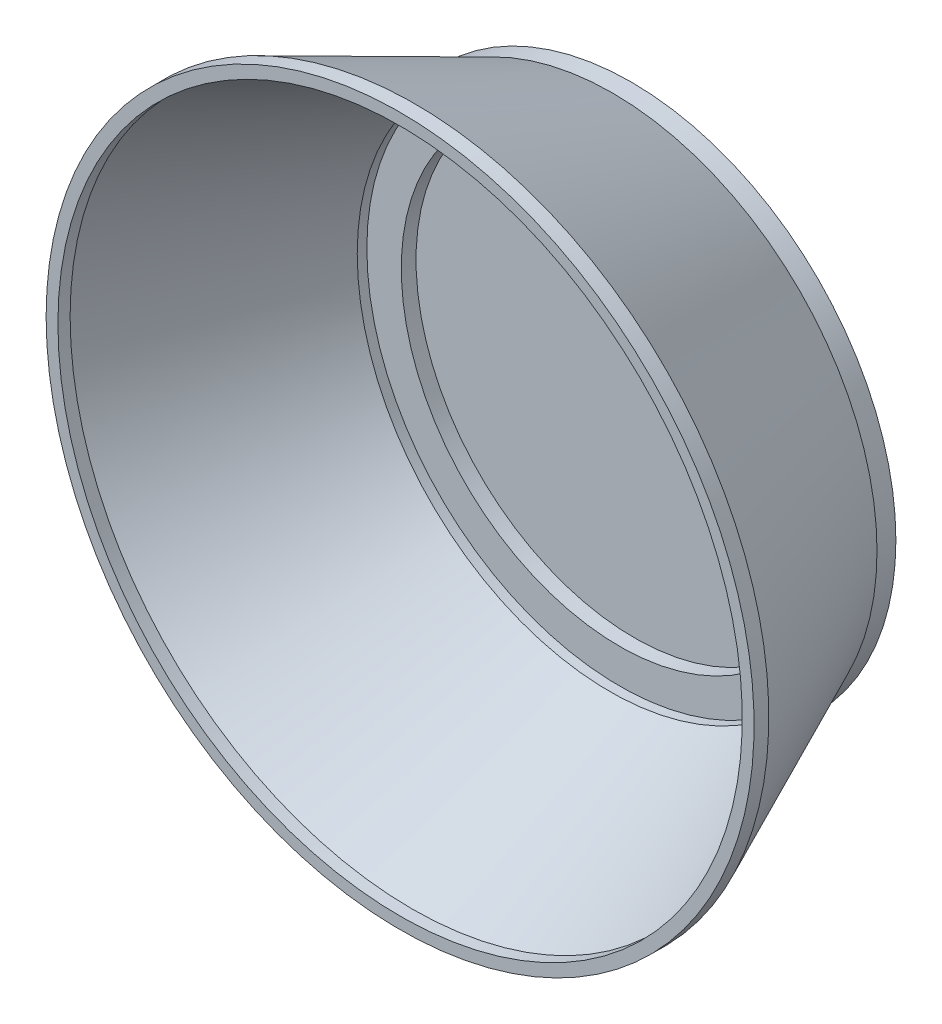
from build123d import *

# Parameters (mm, degrees)
SHELL1_T = -1.27


with BuildPart() as part:
    # Sketch1 → Revolve1 (revolve)
    with BuildSketch(Plane(origin=(0, 0, 0), x_dir=(-1, 0, 0), z_dir=(0, 1, 0)), mode=Mode.PRIVATE) as revolve1_sk:
        Polygon((0, 0), (0, 26.4795), (-38.1, 26.4795), (-38.1, 24.892), (-28.47032967, 3.6195), (-28.47032967, 1.5875), (-24.765, 1.5875), (-24.765, 0), align=None)
    revolve(revolve1_sk.sketch.rotate(Axis((0, 0, 0), (0, 0, 1)), 180), axis=Axis((0, 0, 0), (0, 0, 1)))

    # Shell1
    shell1_openings = [part.faces().sort_by_distance(p)[0] for p in [
        (0, 0, 26.4795),
    ]]
    offset(amount=SHELL1_T, openings=shell1_openings, kind=Kind.INTERSECTION)


solid = part.part
